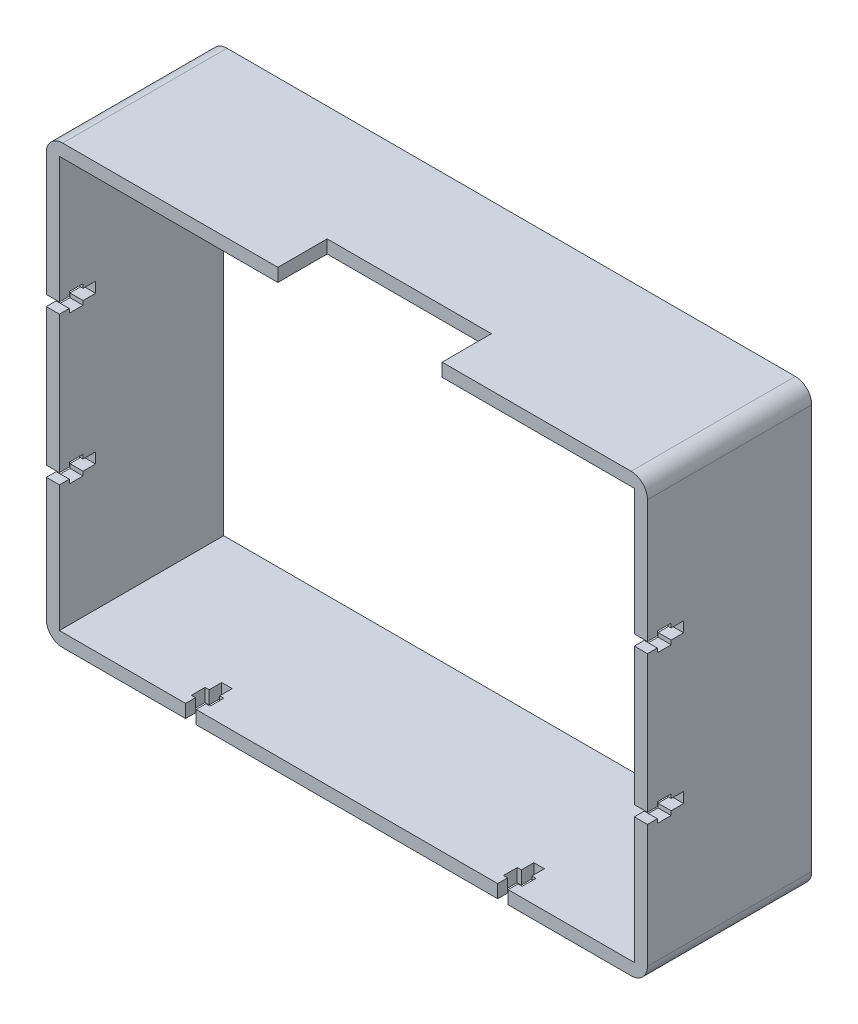
from build123d import *

# Parameters (mm, degrees)
ESQUISSE2_W             = 183
ESQUISSE2_H             = 133
BOSS_EXTRU_2_DEPTH      = 50
ESQUISSE3_W             = 50
ESQUISSE3_H             = 15
ENL_V_MAT_EXTRU_1_DEPTH = 50
CONG_1_R                = 5
ENL_V_MAT_EXTRU_3_DEPTH = 4
ENL_V_MAT_EXTRU_4_DEPTH = 4
ENL_V_MAT_EXTRU_5_DEPTH = 4


with BuildPart() as part:
    # Esquisse2 → Boss.-Extru.2 (new body)
    with BuildSketch(Plane.XY):
        Rectangle(ESQUISSE2_W, ESQUISSE2_H)
        Polygon((-85.996240602, -62.5), (-87.5, -62.5), (-87.5, 62.5), (87.5, 62.5), (87.5, -62.5), align=None, mode=Mode.SUBTRACT)
    extrude(amount=BOSS_EXTRU_2_DEPTH)

    # Esquisse3 → Enlèv. mat.-Extru.1 (cut)
    with BuildSketch(Plane(origin=(0, 66.5, 0), x_dir=(1, 0, 0), z_dir=(0, 1, 0))):
        with Locations((4, -42.5)):
            Rectangle(ESQUISSE3_W, ESQUISSE3_H)
    extrude(amount=-ENL_V_MAT_EXTRU_1_DEPTH, mode=Mode.SUBTRACT)

    # Congé1
    cong_1_edges = [part.edges().sort_by_distance(p)[0] for p in [
        (91.5, -66.5, 25),
        (91.5, 66.5, 25),
        (-91.5, 66.5, 25),
        (-91.5, -66.5, 25),
    ]]
    fillet(cong_1_edges, radius=CONG_1_R)

    # Esquisse6 → Enlèv. mat.-Extru.3 (cut)
    with BuildSketch(Plane(origin=(91.5, 0, 0), x_dir=(0, 0, -1), z_dir=(1, 0, 0))):
        Polygon((-50, 20.9), (-47, 20.9), (-47, 19.65), (-42.8, 19.65), (-42.8, 20.9), (-39, 20.9), (-39, 24.1), (-42.8, 24.1), (-42.8, 25.35), (-47, 25.35), (-47, 24.1), (-50, 24.1), align=None)
        Polygon((-50, -24.1), (-47, -24.1), (-47, -25.35), (-42.8, -25.35), (-42.8, -24.1), (-39, -24.1), (-39, -20.9), (-42.8, -20.9), (-42.8, -19.65), (-47, -19.65), (-47, -20.9), (-50, -20.9), align=None)
    extrude(amount=-ENL_V_MAT_EXTRU_3_DEPTH, mode=Mode.SUBTRACT)

    # Esquisse7 → Enlèv. mat.-Extru.4 (cut)
    with BuildSketch(Plane.ZY.offset(91.5)):
        Polygon((47, 20.9), (50, 20.9), (50, 24.1), (47, 24.1), (47, 25.35), (42.8, 25.35), (42.8, 24.1), (39, 24.1), (39, 20.9), (42.8, 20.9), (42.8, 19.65), (47, 19.65), align=None)
        Polygon((47, -24.1), (50, -24.1), (50, -20.9), (47, -20.9), (47, -19.65), (42.8, -19.65), (42.8, -20.9), (39, -20.9), (39, -24.1), (42.8, -24.1), (42.8, -25.35), (47, -25.35), align=None)
    extrude(amount=-ENL_V_MAT_EXTRU_4_DEPTH, mode=Mode.SUBTRACT)

    # Esquisse9 → Enlèv. mat.-Extru.5 (cut)
    with BuildSketch(Plane.XZ.offset(66.5)):
        Polygon((-49.1, 50), (-45.9, 50), (-45.9, 47), (-44.65, 47), (-44.65, 42.8), (-45.9, 42.8), (-45.9, 39), (-49.1, 39), (-49.1, 42.8), (-50.35, 42.8), (-50.35, 47), (-49.1, 47), align=None)
        Polygon((45.9, 50), (45.9, 47), (44.65, 47), (44.65, 42.8), (45.9, 42.8), (45.9, 39), (49.1, 39), (49.1, 42.8), (50.35, 42.8), (50.35, 47), (49.1, 47), (49.1, 50), align=None)
    extrude(amount=-ENL_V_MAT_EXTRU_5_DEPTH, mode=Mode.SUBTRACT)


solid = part.part
